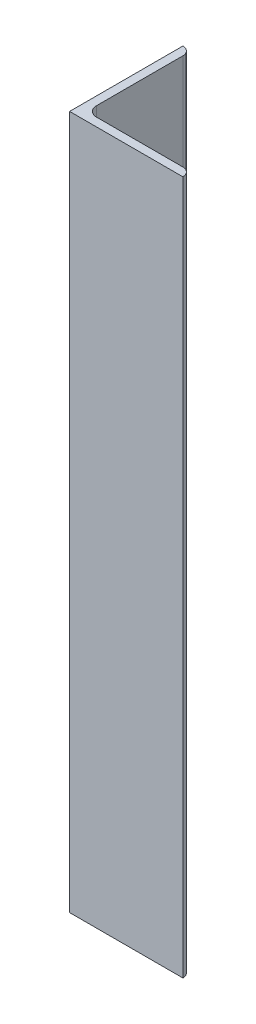
from build123d import *

# Parameters (mm, degrees)
IRON_V40X40X3_1_DEPTH = 245
CUT_EXTRUDE1_DEPTH    = 10


with BuildPart() as part:
    # Sketch1 → Iron V40X40X3(1) (new body)
    with BuildSketch(Plane(origin=(0, 0, 0), x_dir=(1, 0, 0), z_dir=(0, 1, 0))):
        with BuildLine():
            Line((0, 0), (0, 40))
            ThreePointArc((0, 40), (2.121320344, 39.121320344), (3, 37))
            Line((3, 37), (3, 6.5))
            ThreePointArc((3, 6.5), (4.025126266, 4.025126266), (6.5, 3))
            Line((6.5, 3), (37, 3))
            ThreePointArc((37, 3), (39.121320344, 2.121320344), (40, 0))
            Line((40, 0), (0, 0))
        make_face()
    extrude(amount=IRON_V40X40X3_1_DEPTH)

    # Sketch2 → Cut-Extrude1 (cut)
    with BuildSketch(Plane.ZY):
        with BuildLine():
            Line((-25.5, 170), (-10.5, 170))
            ThreePointArc((-10.5, 170), (-5.5, 165), (-10.5, 160))
            Line((-10.5, 160), (-25.5, 160))
            ThreePointArc((-25.5, 160), (-30.5, 165), (-25.5, 170))
        make_face()
        with BuildLine():
            Line((-25.5, 200), (-10.5, 200))
            ThreePointArc((-10.5, 200), (-5.5, 195), (-10.5, 190))
            Line((-10.5, 190), (-25.5, 190))
            ThreePointArc((-25.5, 190), (-30.5, 195), (-25.5, 200))
        make_face()
    extrude(amount=-CUT_EXTRUDE1_DEPTH, mode=Mode.SUBTRACT)


solid = part.part
